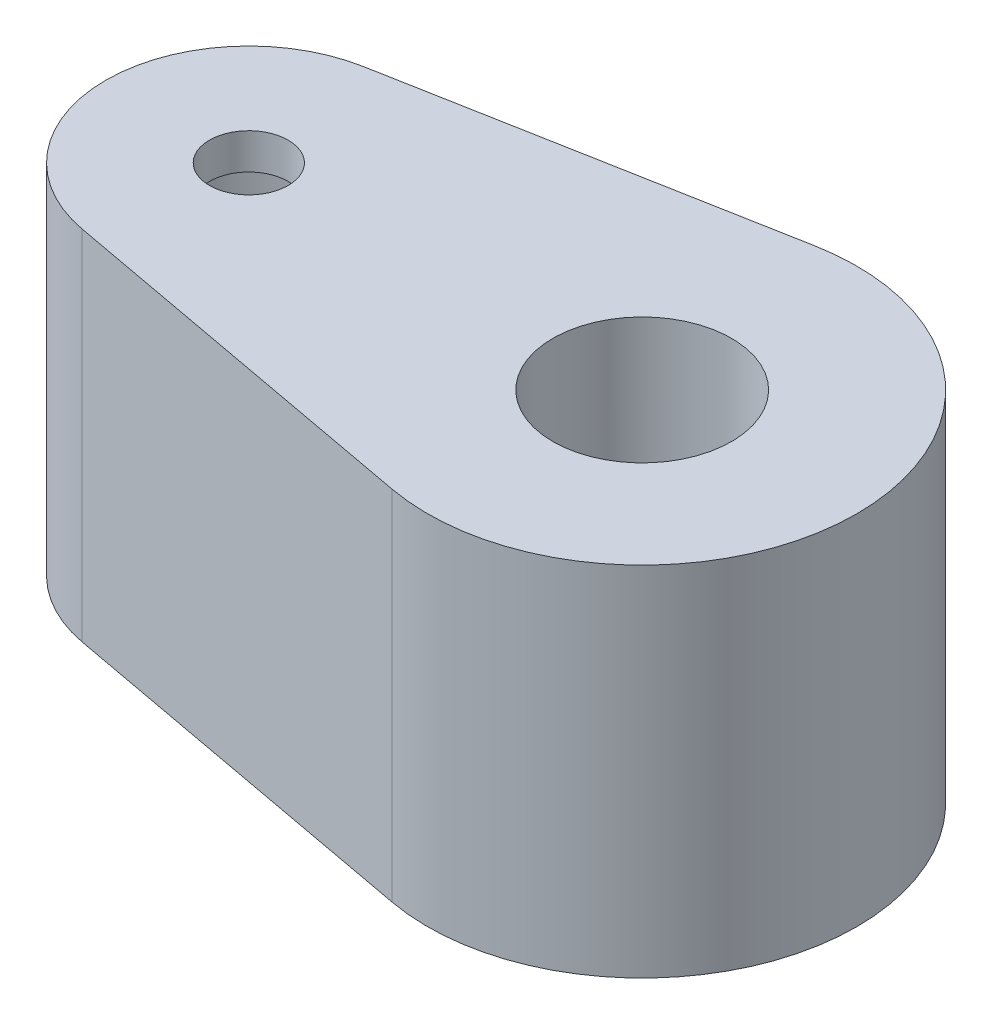
from build123d import *

# Parameters (mm, degrees)
SKETCH_1_R          = 1.5
SKETCH_1_R_2        = 1.1
EXTRUDE_1_DEPTH     = 6.5
EXTRUDE_START       = 1
SKETCH_2_R          = 4
SKETCH_2_R_2        = 1.1
EXTRUDE_2_DEPTH     = 1
EXTRUDE_START_2     = 9
SKETCH_3_R          = 4
SKETCH_3_R_2        = 3.25
EXTRUDE_3_DEPTH     = 9
EXTRUDE_START_3     = -10
SKETCH_4_R          = 2.5
EXTRUDE_4_DEPTH     = 10
SKETCH_5_R          = 4.5
CUT_EXTRUDE_1_DEPTH = 3
CUT_EXTRUDE_START   = -6.5
SKETCH_7_R          = 1.5
CUT_EXTRUDE_2_DEPTH = 6.5


with BuildPart() as part:
    # Эскиз1 → Бобышка-Вытянуть1 (new body)
    with BuildSketch(Plane(origin=(0, 0, 0), x_dir=(1, 0, 0), z_dir=(0, 1, 0))):
        with Locations(Location((0, 0, 0), (0, 0, 90))):
            Circle(SKETCH_1_R)
        with Locations(Location((0, 0, 0), (0, 0, 90))):
            Circle(SKETCH_1_R_2, mode=Mode.SUBTRACT)
    extrude(amount=EXTRUDE_1_DEPTH)

    # Эскиз2 → Бобышка-Вытянуть2 (add)
    with BuildSketch(Plane.XZ.offset(EXTRUDE_START)):
        with Locations(Location((0, 0, 0), (0, 0, 270))):
            Circle(SKETCH_2_R)
        with Locations(Location((0, 0, 0), (0, 0, 270))):
            Circle(SKETCH_2_R_2, mode=Mode.SUBTRACT)
    extrude(amount=-EXTRUDE_2_DEPTH)

    # Эскиз3 → Бобышка-Вытянуть3 (add)
    with BuildSketch(Plane.XZ.offset(1).offset(EXTRUDE_START_2)):
        with Locations(Location((0, 0, 0), (0, 0, 270))):
            Circle(SKETCH_3_R)
        with Locations(Location((0, 0, 0), (0, 0, 270))):
            Circle(SKETCH_3_R_2, mode=Mode.SUBTRACT)
    extrude(amount=-EXTRUDE_3_DEPTH)

    # Эскиз4 → Бобышка-Вытянуть4 (add)
    with BuildSketch(Plane(origin=(0, 0, 0), x_dir=(1, 0, 0), z_dir=(0, 1, 0)).offset(EXTRUDE_START_3)):
        with BuildLine():
            ThreePointArc((-0.727272727, 3.933328664), (4, 0), (-0.727272727, -3.933328664))
            Line((-0.727272727, -3.933328664), (9.909090909, -5.899992996))
            ThreePointArc((9.909090909, -5.899992996), (17, 0), (9.909090909, 5.899992996))
            Line((9.909090909, 5.899992996), (-0.727272727, 3.933328664))
        make_face()
        with Locations(Location((11, 0, 0), (0, 0, 270))):
            Circle(SKETCH_4_R, mode=Mode.SUBTRACT)
    extrude(amount=EXTRUDE_4_DEPTH)

    # Эскиз5 → Вырез-Вытянуть1 (cut)
    with BuildSketch(Plane.XZ.offset(10)):
        with Locations(Location((11, 0, 0), (0, 0, 270))):
            Circle(SKETCH_5_R)
    extrude(amount=-CUT_EXTRUDE_1_DEPTH, mode=Mode.SUBTRACT)

    # Эскиз7 → Вырез-Вытянуть2 (cut)
    with BuildSketch(Plane(origin=(0, 6.5, 0), x_dir=(1, 0, 0), z_dir=(0, 1, 0)).offset(CUT_EXTRUDE_START)):
        Circle(SKETCH_7_R)
    extrude(amount=CUT_EXTRUDE_2_DEPTH, mode=Mode.SUBTRACT)


solid = part.part
